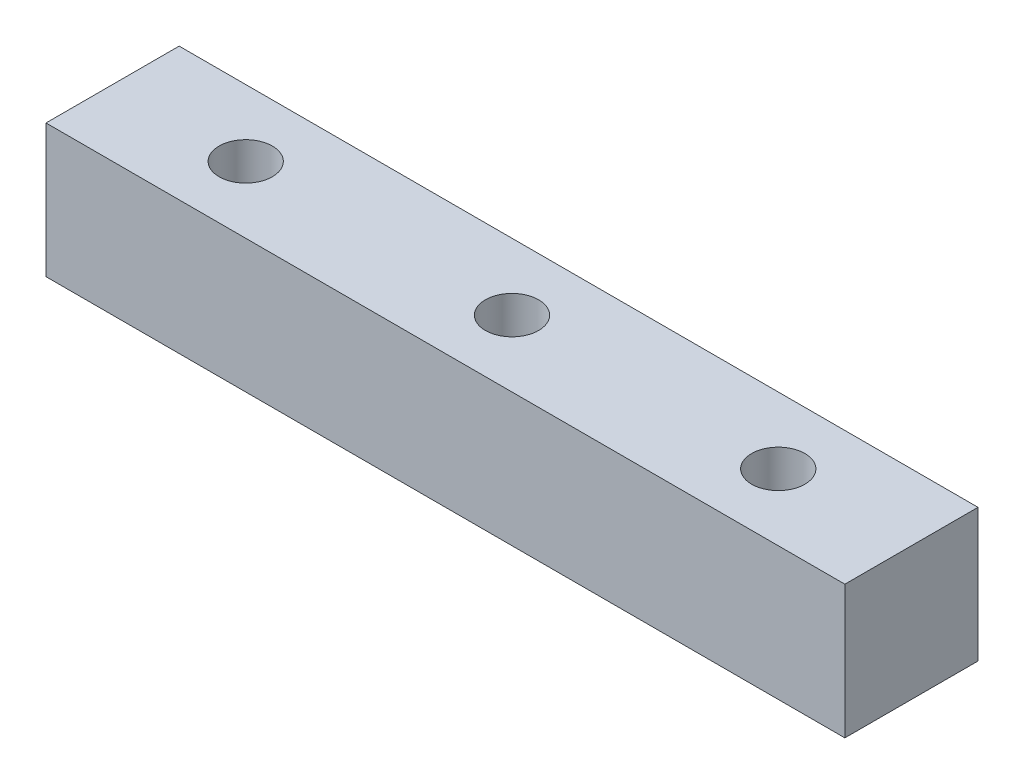
from build123d import *

# Parameters (mm, degrees)
SKETCH1_W           = 60
SKETCH1_H           = 10
SKETCH1_R           = 2
BOSS_EXTRUDE1_DEPTH = 10


with BuildPart() as part:
    # Sketch1 → Boss-Extrude1 (new body)
    with BuildSketch(Plane(origin=(0, 0, 0), x_dir=(1, 0, 0), z_dir=(0, 1, 0))):
        with Locations((30, 5)):
            Rectangle(SKETCH1_W, SKETCH1_H)
        with Locations(Location((10, 5, 0), (0, 0, 270))):
            Circle(SKETCH1_R, mode=Mode.SUBTRACT)
        with Locations(Location((30, 5, 0), (0, 0, 270))):
            Circle(SKETCH1_R, mode=Mode.SUBTRACT)
        with Locations(Location((50, 5, 0), (0, 0, 270))):
            Circle(SKETCH1_R, mode=Mode.SUBTRACT)
    extrude(amount=BOSS_EXTRUDE1_DEPTH)


solid = part.part
